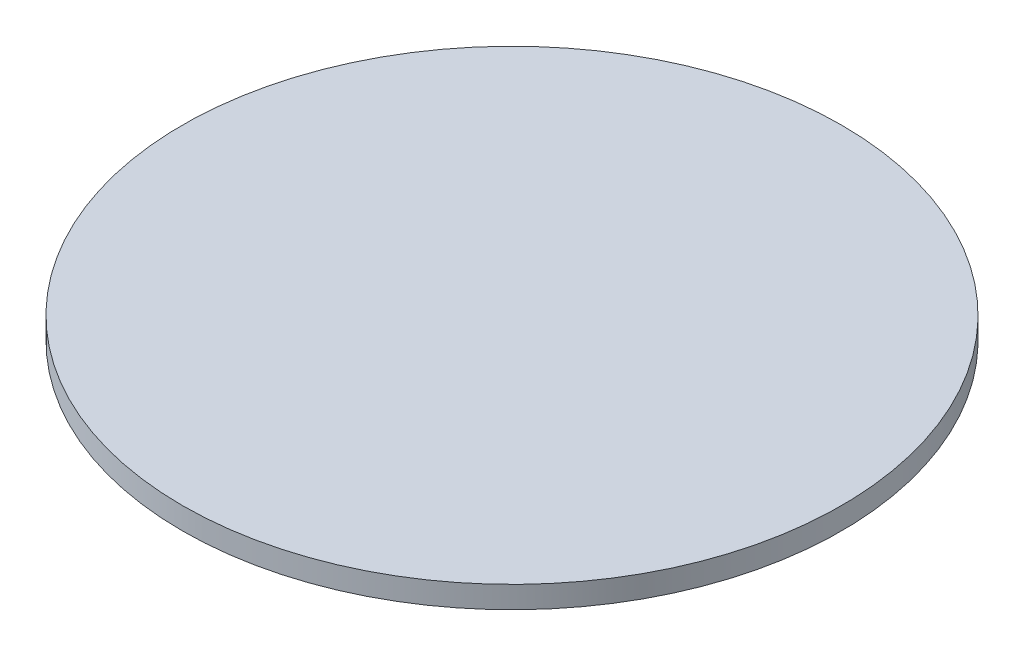
from build123d import *

# Parameters (mm, degrees)
SKETCH1_R           = 38.1
BOSS_EXTRUDE1_DEPTH = 2.54


with BuildPart() as part:
    # Sketch1 → Boss-Extrude1 (new body)
    with BuildSketch(Plane(origin=(0, 0, 0), x_dir=(1, 0, 0), z_dir=(0, 1, 0))):
        with Locations(Location((0, 0, 0), (0, 0, 270))):
            Circle(SKETCH1_R)
    extrude(amount=BOSS_EXTRUDE1_DEPTH)


solid = part.part
